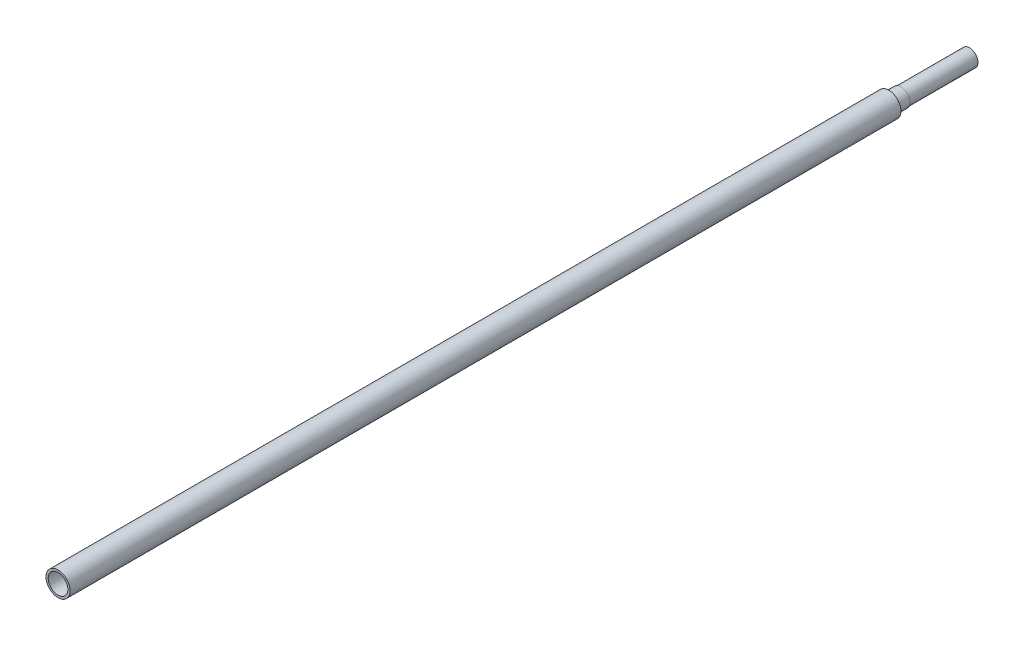
from build123d import *

# Parameters (mm, degrees)
SKETCH_1_R      = 7
EXTRUDE_1_DEPTH = 57
SKETCH_2_R      = 7.5
EXTRUDE_2_DEPTH = 10
SKETCH_3_R      = 10
EXTRUDE_3_DEPTH = 690


with BuildPart() as part:
    # 草图1 → 凸台-拉伸1 (new body)
    with BuildSketch(Plane.XY):
        with Locations(Location((0, 0, 0), (0, 0, 180))):
            Circle(SKETCH_1_R)
    extrude(amount=EXTRUDE_1_DEPTH)

    # 草图2 → 凸台-拉伸2 (add)
    with BuildSketch(Plane.XY.offset(57)):
        Circle(SKETCH_2_R)
    extrude(amount=EXTRUDE_2_DEPTH)

    # 草图3 → 凸台-拉伸3 (add)
    with BuildSketch(Plane.XY.offset(67)):
        Circle(SKETCH_3_R)
    extrude(amount=EXTRUDE_3_DEPTH)

    # 草图4 → 切除-旋转1 (revolve, cut)
    with BuildSketch(Plane(origin=(0, 0, 0), x_dir=(0, 0, -1), z_dir=(1, 0, 0)), mode=Mode.PRIVATE) as cut_revolve_1_sk:
        Polygon((-757, 0), (-757, 5), (-761.492335199, 8.145566971), (-738.304335199, 8.145566971), (-733.601489916, 0), align=None)
    revolve(cut_revolve_1_sk.sketch.rotate(Axis((0, 0, 772.39343623), (0, 0, -1)), 90), axis=Axis((0, 0, 772.39343623), (0, 0, -1)), mode=Mode.SUBTRACT)


solid = part.part
